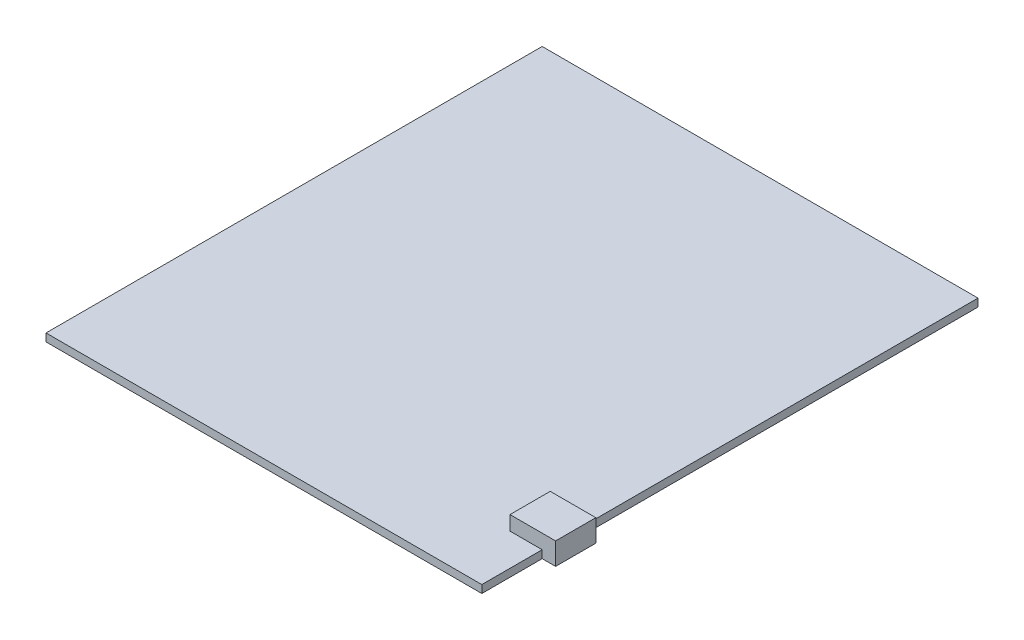
from build123d import *

# Parameters (mm, degrees)
SKETCH1_W           = 82.55
SKETCH1_H           = 93.98
BOSS_EXTRUDE1_DEPTH = 1.4732
SKETCH2_W           = 8.636
SKETCH2_H           = 7.62
BOSS_EXTRUDE2_DEPTH = 4.191
SKETCH3_R           = 4.7625
BOSS_EXTRUDE3_DEPTH = 3.6068


with BuildPart() as part:
    # Sketch1 → Boss-Extrude1 (new body)
    with BuildSketch(Plane(origin=(0, 0, 0), x_dir=(1, 0, 0), z_dir=(0, 1, 0))):
        Rectangle(SKETCH1_W, SKETCH1_H)
    extrude(amount=BOSS_EXTRUDE1_DEPTH)

    # Sketch2 → Boss-Extrude2 (add)
    with BuildSketch(Plane(origin=(0, 0, 0), x_dir=(1, 0, 0), z_dir=(0, 1, 0))):
        with Locations((39.497, -31.75)):
            Rectangle(SKETCH2_W, SKETCH2_H)
    extrude(amount=BOSS_EXTRUDE2_DEPTH)

    # Sketch3 → Boss-Extrude3 (add)
    with BuildSketch(Plane.XZ):
        with Locations(Location((-31.75, 38.1, 0), (0, 0, 270))):
            Circle(SKETCH3_R)
        with Locations(Location((31.75, 38.1, 0), (0, 0, 270))):
            Circle(SKETCH3_R)
        with Locations(Location((-31.75, -38.1, 0), (0, 0, 270))):
            Circle(SKETCH3_R)
        with Locations(Location((31.75, -38.1, 0), (0, 0, 270))):
            Circle(SKETCH3_R)
    extrude(amount=BOSS_EXTRUDE3_DEPTH)


solid = part.part
